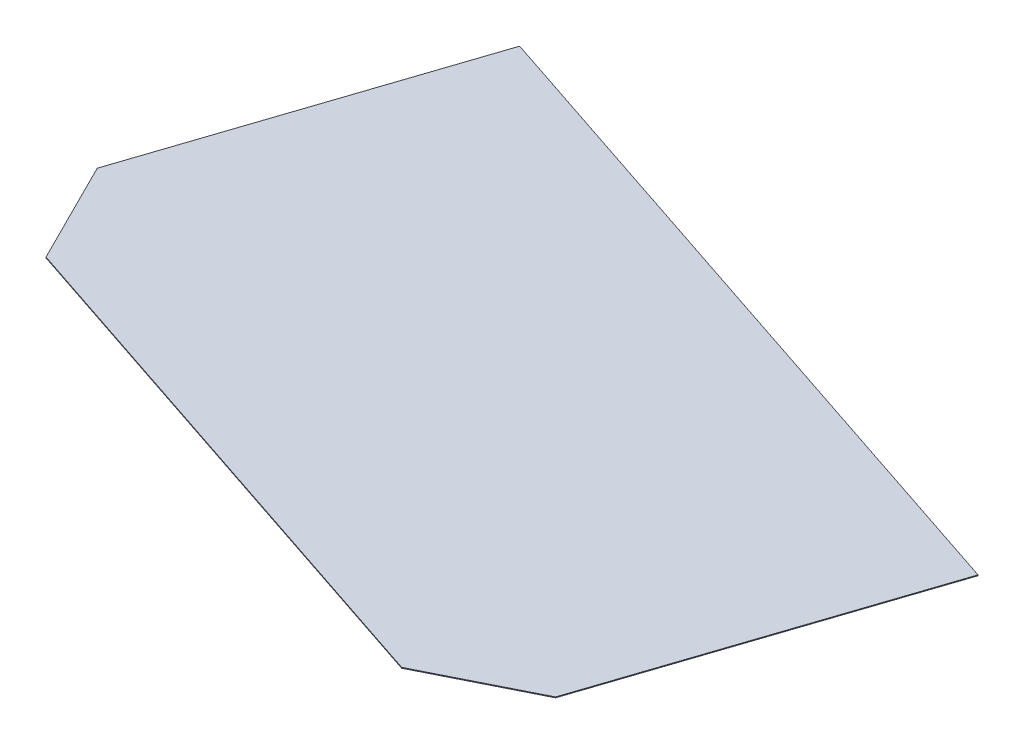
from build123d import *

# Parameters (mm, degrees)
COVERGLASS_DEPTH = 0.0381


with BuildPart() as part:
    # Sketch1 → Coverglass (new, symmetric)
    with BuildSketch(Plane(origin=(0, 0, 0), x_dir=(1, 0, 0), z_dir=(0, 1, 0))):
        Polygon((108.264082638, -39.263603606), (42.890975081, -17.5020134), (32.852490799, -47.658215516), (37.737021663, -57.417383424), (88.46643045, -74.304336586), (98.225598357, -69.419805722), align=None)
    extrude(amount=COVERGLASS_DEPTH, both=True)


solid = part.part
